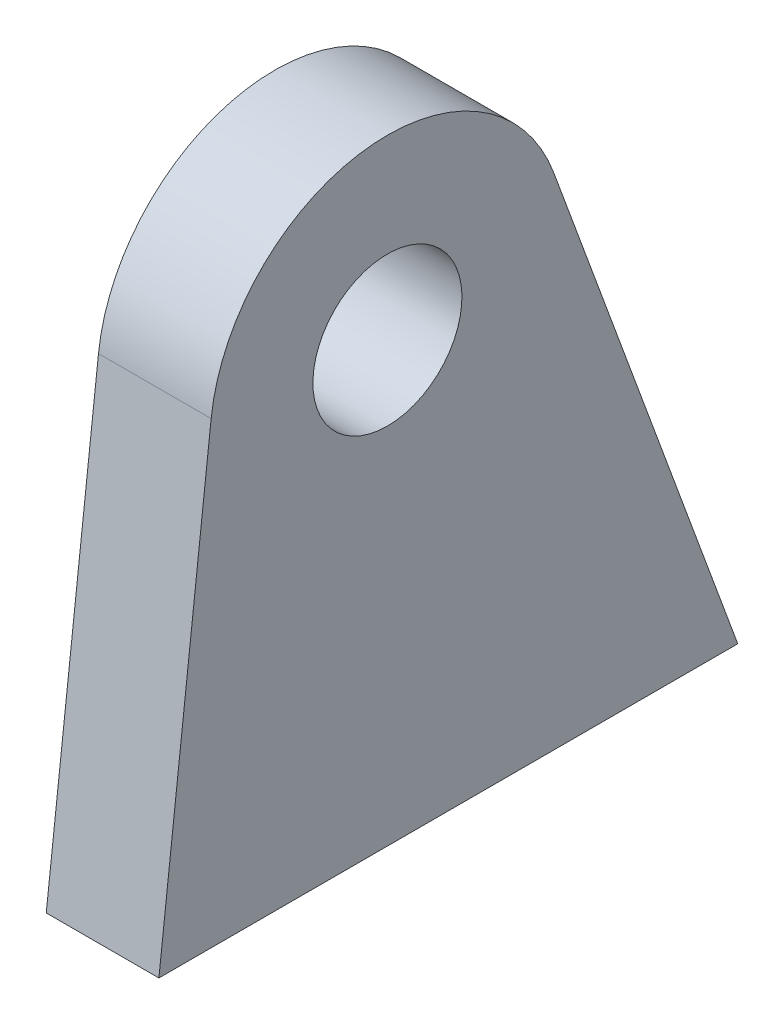
from build123d import *

# Parameters (mm, degrees)
SKETCH1_R           = 4.2
BOSS_EXTRUDE1_DEPTH = 6.35


with BuildPart() as part:
    # Sketch1 → Boss-Extrude1 (new body)
    with BuildSketch(Plane.ZY.offset(81.7)):
        with BuildLine():
            Line((-916.713582015, 360.677443288), (-927.075106991, 332.523601629))
            Line((-927.075106991, 332.523601629), (-894.448362552, 332.523601629))
            Line((-894.448362552, 332.523601629), (-897.39332308, 358.356278755))
            ThreePointArc((-897.39332308, 358.356278755), (-906.13613116, 367.152203744), (-916.713582015, 360.677443288))
        make_face()
        with Locations(Location((-907.328968128, 357.223601629, 0), (0, 0, 270))):
            Circle(SKETCH1_R, mode=Mode.SUBTRACT)
    extrude(amount=BOSS_EXTRUDE1_DEPTH)


solid = part.part
